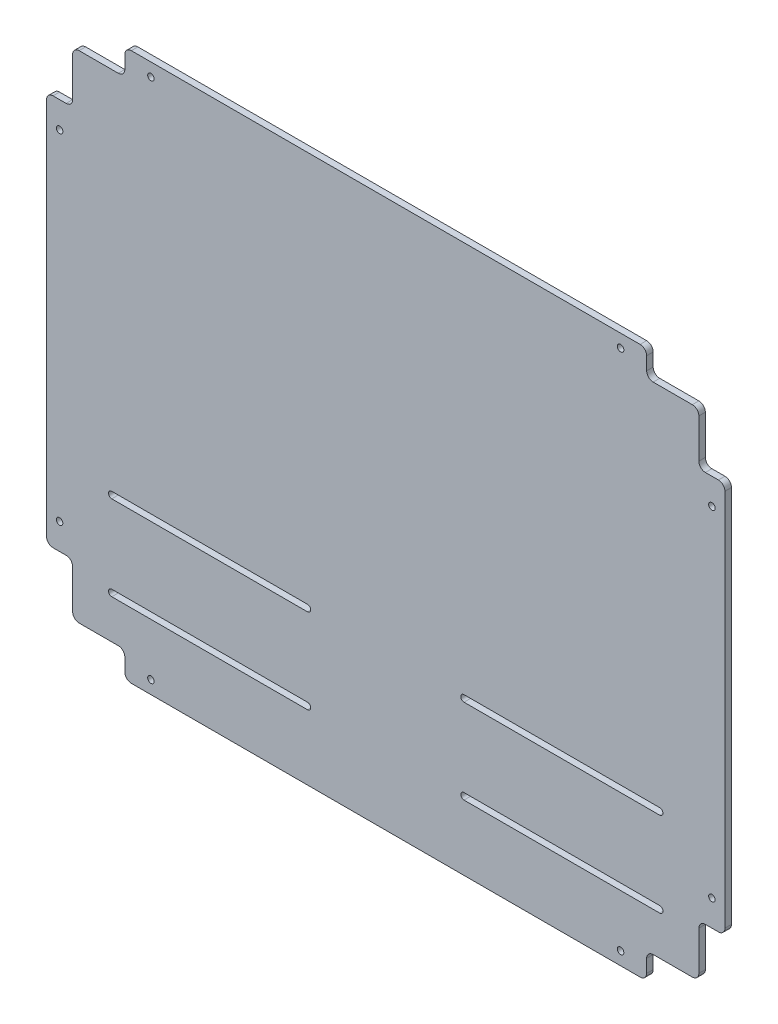
from build123d import *

# Parameters (mm, degrees)
SKETCH_1_W          = 520
SKETCH_1_H          = 420
EXTRUDE_2_DEPTH     = 5
SKETCH_2_R          = 2.5
CUT_EXTRUDE_1_DEPTH = 335.252898267
FILLET_1_R          = 5
CUT_EXTRUDE_2_DEPTH = 10


with BuildPart() as part:
    # 草图1 → 凸台-拉伸2 (new body)
    with BuildSketch(Plane.XY):
        Rectangle(SKETCH_1_W, SKETCH_1_H)
    extrude(amount=EXTRUDE_2_DEPTH)

    # 草图2 → 切除-拉伸1 (cut, through all)
    with BuildSketch(Plane(origin=(0, 0, 0), x_dir=(-1, 0, 0), z_dir=(0, 0, -1))):
        with Locations((-180, 200)):
            Circle(SKETCH_2_R)
        with Locations((-250, 130)):
            Circle(SKETCH_2_R)
        with Locations((-250, -130)):
            Circle(SKETCH_2_R)
        with Locations((-180, -200)):
            Circle(SKETCH_2_R)
        with Locations((180, -200)):
            Circle(SKETCH_2_R)
        with Locations((250, -130)):
            Circle(SKETCH_2_R)
        with Locations((250, 130)):
            Circle(SKETCH_2_R)
        with Locations((180, 200)):
            Circle(SKETCH_2_R)
        Polygon((240, -190), (240, -150), (260, -150), (260, -210), (200, -210), (200, -190), align=None)
        Polygon((240, 190), (200, 190), (200, 210), (260, 210), (260, 150), (240, 150), align=None)
        Polygon((-240, 190), (-240, 150), (-260, 150), (-260, 210), (-200, 210), (-200, 190), align=None)
        Polygon((-240, -190), (-200, -190), (-200, -210), (-260, -210), (-260, -150), (-240, -150), align=None)
    extrude(amount=-CUT_EXTRUDE_1_DEPTH, mode=Mode.SUBTRACT)

    # 圆角1
    fillet_1_edges = [part.edges().sort_by_distance(p)[0] for p in [
        (-240, 150, 2.5),
        (-240, 190, 2.5),
        (-200, 190, 2.5),
        (-200, 210, 2.5),
        (-260, 150, 2.5),
        (-200, -190, 2.5),
        (-240, -190, 2.5),
        (-240, -150, 2.5),
        (-260, -150, 2.5),
        (-200, -210, 2.5),
        (260, -150, 2.5),
        (240, -150, 2.5),
        (240, -190, 2.5),
        (200, -190, 2.5),
        (200, -210, 2.5),
        (200, 210, 2.5),
        (200, 190, 2.5),
        (240, 190, 2.5),
        (240, 150, 2.5),
        (260, 150, 2.5),
    ]]
    fillet(fillet_1_edges, radius=FILLET_1_R)

    # 草图3 → 切除-拉伸2 (cut)
    with BuildSketch(Plane.XY.offset(5)):
        with BuildLine():
            Line((-210, -95), (-60, -95))
            ThreePointArc((-60, -95), (-57.5, -92.5), (-60, -90))
            Line((-60, -90), (-210, -90))
            ThreePointArc((-210, -90), (-212.5, -92.5), (-210, -95))
        make_face()
        with BuildLine():
            Line((-210, -160), (-60, -160))
            ThreePointArc((-60, -160), (-57.5, -157.5), (-60, -155))
            Line((-60, -155), (-210, -155))
            ThreePointArc((-210, -155), (-212.5, -157.5), (-210, -160))
        make_face()
        with BuildLine():
            Line((60, -160), (210, -160))
            ThreePointArc((210, -160), (212.5, -157.5), (210, -155))
            Line((210, -155), (60, -155))
            ThreePointArc((60, -155), (57.5, -157.5), (60, -160))
        make_face()
        with BuildLine():
            Line((60, -95), (210, -95))
            ThreePointArc((210, -95), (212.5, -92.5), (210, -90))
            Line((210, -90), (60, -90))
            ThreePointArc((60, -90), (57.5, -92.5), (60, -95))
        make_face()
    extrude(amount=-CUT_EXTRUDE_2_DEPTH, mode=Mode.SUBTRACT)


solid = part.part
